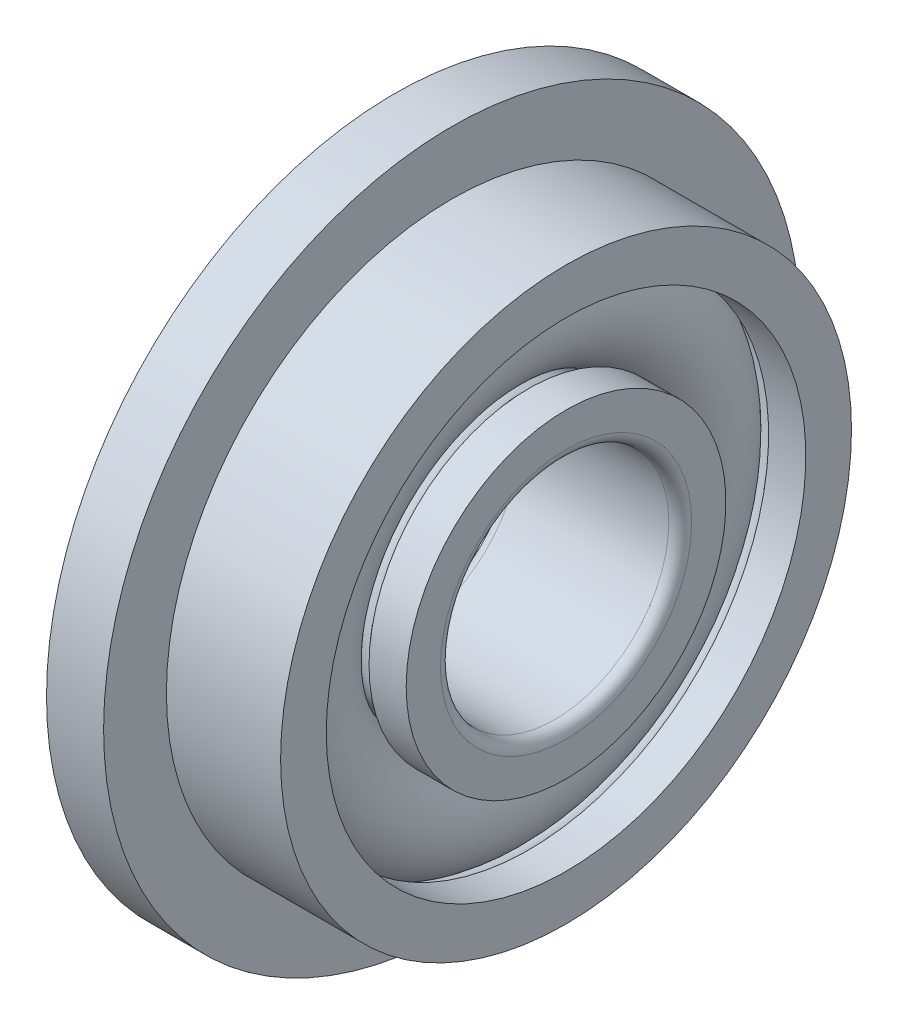
from build123d import *

# Parameters (mm, degrees)
SKETCH_1_R = 0.5
FILLET_2_R = 0.1


with BuildPart() as part:
    # 草图1 → 旋转1 (revolve)
    with BuildSketch(Plane.XY, mode=Mode.PRIVATE) as revolve_1_sk:
        with Locations((0.75, 1.75)):
            Circle(SKETCH_1_R)
        with BuildLine():
            Line((0.5, 2.5), (1.5, 2.5))
            Line((1.5, 2.5), (1.5, 2.1))
            Line((1.5, 2.1), (1.174264069, 2.1))
            ThreePointArc((1.174264069, 2.1), (0.75, 2.3), (0.325735931, 2.1))
            Line((0.325735931, 2.1), (0, 2.1))
            Line((0, 2.1), (0, 2.5))
            Line((0, 2.5), (0, 3.05))
            Line((0, 3.05), (0.5, 3.05))
            Line((0.5, 3.05), (0.5, 2.5))
        make_face()
        with BuildLine():
            Line((0, 1), (1.5, 1))
            Line((1.5, 1), (1.5, 1.4))
            Line((1.5, 1.4), (1.174264069, 1.4))
            ThreePointArc((1.174264069, 1.4), (0.75, 1.2), (0.325735931, 1.4))
            Line((0.325735931, 1.4), (0, 1.4))
            Line((0, 1.4), (0, 1))
        make_face()
    revolve(revolve_1_sk.sketch.rotate(Axis((0, 0, 0), (1, 0, 0)), 90), axis=Axis((0, 0, 0), (1, 0, 0)))

    # 圆角2
    fillet_2_edges = [part.edges().sort_by_distance(p)[0] for p in [
        (1.5, 0, -1),
        (0, 0, -1),
    ]]
    fillet(fillet_2_edges, radius=FILLET_2_R)


solid = part.part
